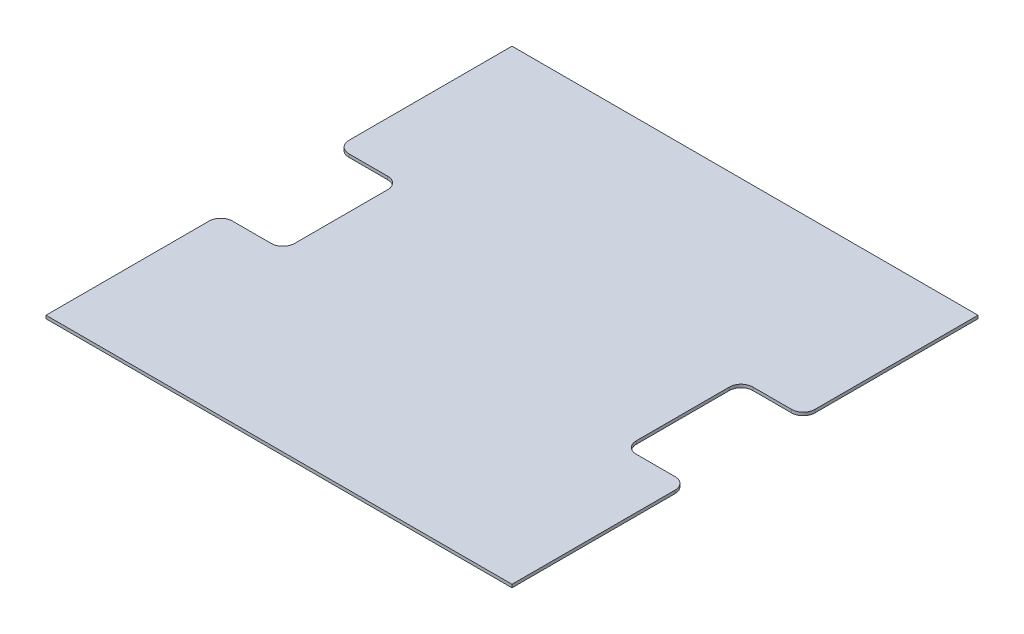
from build123d import *

# Parameters (mm, degrees)
SKETCH_1_W          = 600
SKETCH_1_H          = 600
EXTRUDE_1_DEPTH     = 4
SKETCH_2_W          = 80
SKETCH_2_H          = 150
CUT_EXTRUDE_1_DEPTH = 4
FILLET_1_R          = 15


with BuildPart() as part:
    # 草图1 → 凸台-拉伸1 (new body)
    with BuildSketch(Plane(origin=(0, 0, 0), x_dir=(1, 0, 0), z_dir=(0, 1, 0))):
        Rectangle(SKETCH_1_W, SKETCH_1_H)
    extrude(amount=EXTRUDE_1_DEPTH)

    # 草图2 → 切除-拉伸1 (cut)
    with BuildSketch(Plane.XZ):
        with Locations((260, 0)):
            Rectangle(SKETCH_2_W, SKETCH_2_H)
    cut_extrude_1 = extrude(amount=-CUT_EXTRUDE_1_DEPTH, mode=Mode.SUBTRACT)

    # 镜向1: 切除-拉伸1 across plane
    add(cut_extrude_1.mirror(Plane(origin=(0, 0, 0), x_dir=(0, 0, 1), z_dir=(1, 0, 0))), mode=Mode.SUBTRACT)

    # 圆角1
    fillet_1_edges = [part.edges().sort_by_distance(p)[0] for p in [
        (300, 2, 75),
        (300, 2, -75),
        (220, 2, -75),
        (220, 2, 75),
        (-220, 2, -75),
        (-220, 2, 75),
        (-300, 2, 75),
        (-300, 2, -75),
    ]]
    fillet(fillet_1_edges, radius=FILLET_1_R)


solid = part.part
